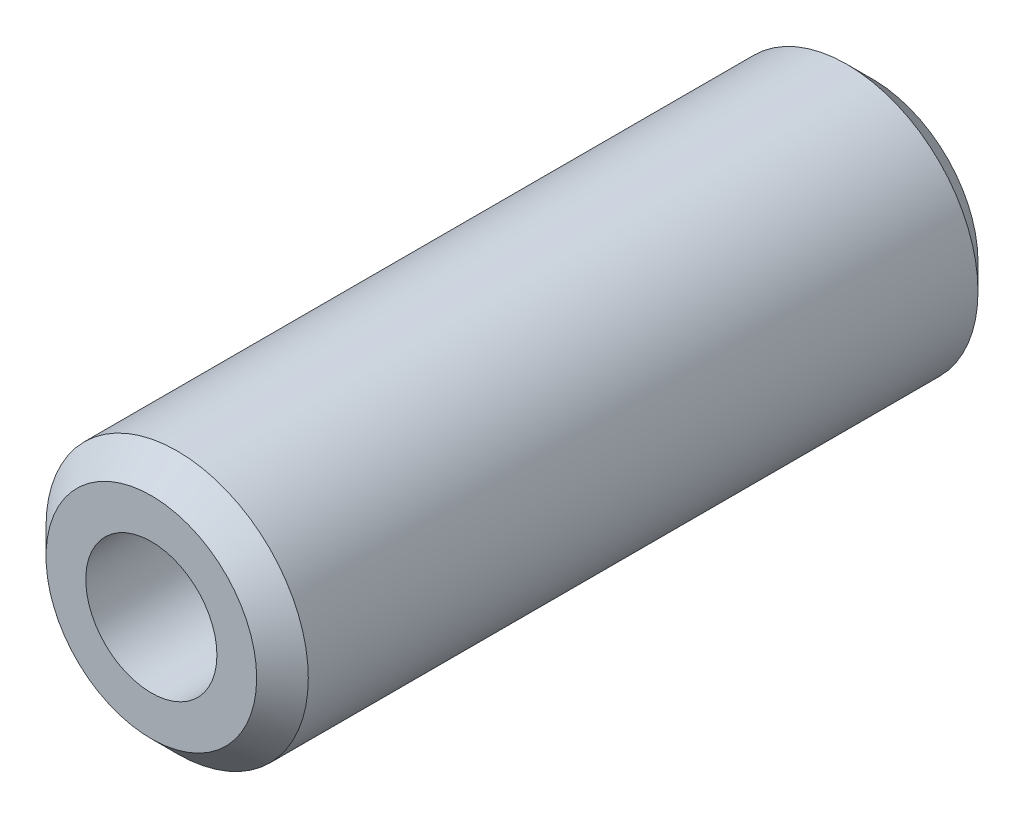
from build123d import *

# Parameters (mm, degrees)
SKETCH1_R           = 12.7
SKETCH1_R_2         = 6.35
BOSS_EXTRUDE1_DEPTH = 69.85
CHAMFER1_SIZE       = 2.5
CHAMFER2_SIZE       = 2.5


with BuildPart() as part:
    # Sketch1 → Boss-Extrude1 (new body)
    with BuildSketch(Plane.XY):
        Circle(SKETCH1_R)
        Circle(SKETCH1_R_2, mode=Mode.SUBTRACT)
    extrude(amount=BOSS_EXTRUDE1_DEPTH)

    # Chamfer1
    chamfer1_edges = [part.edges().sort_by_distance(p)[0] for p in [
        (-12.7, 0, 69.85),
    ]]
    chamfer(chamfer1_edges, length=CHAMFER1_SIZE)

    # Chamfer2
    chamfer2_edges = [part.edges().sort_by_distance(p)[0] for p in [
        (-12.7, 0, 0),
    ]]
    chamfer(chamfer2_edges, length=CHAMFER2_SIZE)


solid = part.part
